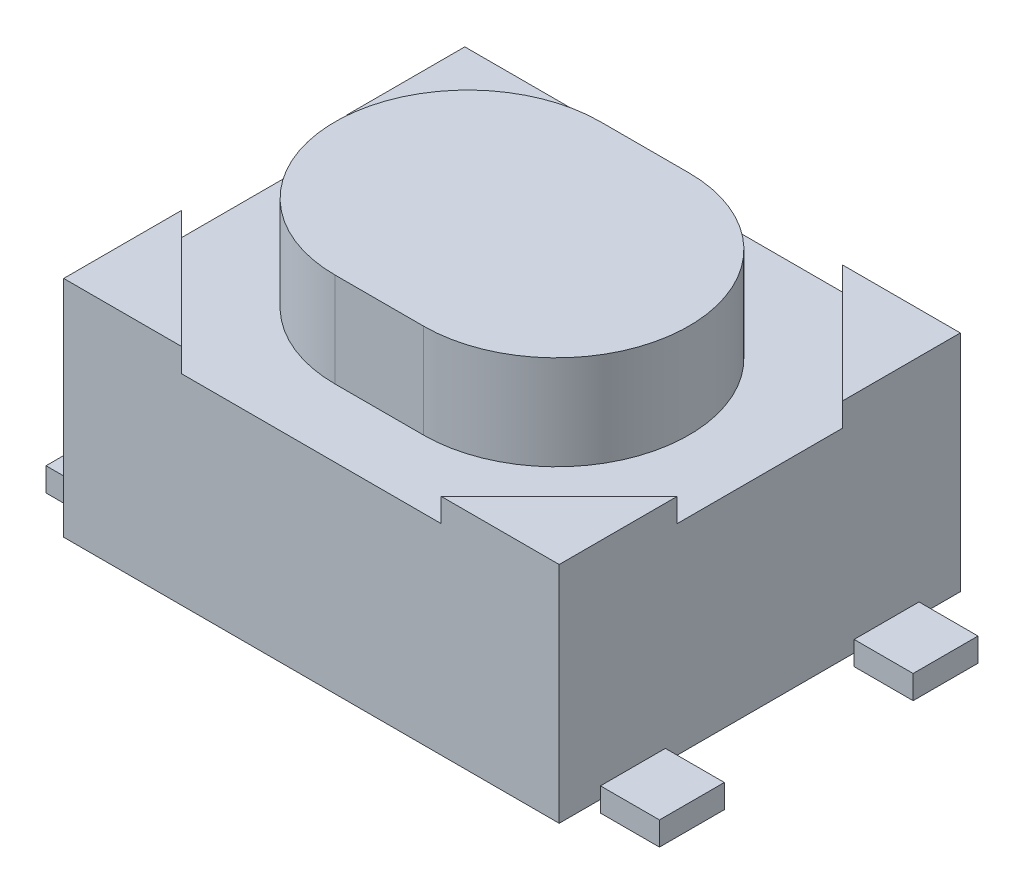
from build123d import *

# Parameters (mm, degrees)
SKETCH1_W           = 4.2
SKETCH1_H           = 3.4
BOSS_EXTRUDE1_DEPTH = 1.7
SKETCH2_W           = 0.5
SKETCH2_H           = 0.55
BOSS_EXTRUDE2_DEPTH = 0.1
BOSS_EXTRUDE3_DEPTH = 0.2
BOSS_EXTRUDE4_DEPTH = 0.8


with BuildPart() as part:
    # Sketch1 → Boss-Extrude1 (new body)
    with BuildSketch(Plane(origin=(0, 0, 0), x_dir=(1, 0, 0), z_dir=(0, 1, 0))):
        Rectangle(SKETCH1_W, SKETCH1_H)
    extrude(amount=BOSS_EXTRUDE1_DEPTH)

    # Sketch2 → Boss-Extrude2 (add, symmetric)
    with BuildSketch(Plane.XZ):
        with Locations((2.35, 1.075)):
            Rectangle(SKETCH2_W, SKETCH2_H)
        with Locations((2.35, -1.075)):
            Rectangle(SKETCH2_W, SKETCH2_H)
        with Locations((-2.35, -1.075)):
            Rectangle(SKETCH2_W, SKETCH2_H)
        with Locations((-2.35, 1.075)):
            Rectangle(SKETCH2_W, SKETCH2_H)
    extrude(amount=BOSS_EXTRUDE2_DEPTH, both=True)

    # Sketch3 → Boss-Extrude3 (add)
    with BuildSketch(Plane(origin=(0, 1.7, 0), x_dir=(1, 0, 0), z_dir=(0, 1, 0))):
        Polygon((-2.1, 1.7), (-1.1, 1.7), (-2.1, 0.7), align=None)
        Polygon((1.1, 1.7), (2.1, 0.7), (2.1, 1.7), align=None)
        Polygon((-2.1, -0.7), (-1.1, -1.7), (-2.1, -1.7), align=None)
        Polygon((1.1, -1.7), (2.1, -0.7), (2.1, -1.7), align=None)
    extrude(amount=BOSS_EXTRUDE3_DEPTH)

    # Sketch4 → Boss-Extrude4 (add)
    with BuildSketch(Plane(origin=(0, 1.7, 0), x_dir=(1, 0, 0), z_dir=(0, 1, 0))):
        with BuildLine():
            Line((0.375, 1.125), (-0.375, 1.125))
            ThreePointArc((-0.375, 1.125), (-0.184760274, 1.10879838), (0, 1.060660172))
            ThreePointArc((0, 1.060660172), (0.184760274, 1.10879838), (0.375, 1.125))
        make_face()
        with BuildLine():
            ThreePointArc((0, -1.060660172), (-0.184760274, -1.10879838), (-0.375, -1.125))
            Line((-0.375, -1.125), (0.375, -1.125))
            ThreePointArc((0.375, -1.125), (0.184760274, -1.10879838), (0, -1.060660172))
        make_face()
        with BuildLine():
            ThreePointArc((0, 1.060660172), (-0.198360449, 0.967927061), (-0.375, 0.838525492))
            Line((-0.375, 0.838525492), (-0.375, -0.838525492))
            ThreePointArc((-0.375, -0.838525492), (-0.198360449, -0.967927061), (0, -1.060660172))
            ThreePointArc((0, -1.060660172), (0.198360449, -0.967927061), (0.375, -0.838525492))
            Line((0.375, -0.838525492), (0.375, 0.838525492))
            ThreePointArc((0.375, 0.838525492), (0.198360449, 0.967927061), (0, 1.060660172))
        make_face()
        with BuildLine():
            ThreePointArc((1.5, 0), (1.170495129, 0.795495129), (0.375, 1.125))
            Line((0.375, 1.125), (0.375, 0.838525492))
            ThreePointArc((0.375, 0.838525492), (0.651979795, 0.459279327), (0.75, 0))
            ThreePointArc((0.75, 0), (0.651979795, -0.459279327), (0.375, -0.838525492))
            Line((0.375, -0.838525492), (0.375, -1.125))
            ThreePointArc((0.375, -1.125), (1.170495129, -0.795495129), (1.5, 0))
        make_face()
        with BuildLine():
            Line((0.375, 0.838525492), (0.375, 1.125))
            ThreePointArc((0.375, 1.125), (0.184760274, 1.10879838), (0, 1.060660172))
            ThreePointArc((0, 1.060660172), (0.198360449, 0.967927061), (0.375, 0.838525492))
        make_face()
        with BuildLine():
            ThreePointArc((0, -1.060660172), (0.184760274, -1.10879838), (0.375, -1.125))
            Line((0.375, -1.125), (0.375, -0.838525492))
            ThreePointArc((0.375, -0.838525492), (0.198360449, -0.967927061), (0, -1.060660172))
        make_face()
        with BuildLine():
            ThreePointArc((0, 1.060660172), (-0.184760274, 1.10879838), (-0.375, 1.125))
            Line((-0.375, 1.125), (-0.375, 0.838525492))
            ThreePointArc((-0.375, 0.838525492), (-0.198360449, 0.967927061), (0, 1.060660172))
        make_face()
        with BuildLine():
            Line((-0.375, 0.838525492), (-0.375, 1.125))
            ThreePointArc((-0.375, 1.125), (-1.5, 0), (-0.375, -1.125))
            Line((-0.375, -1.125), (-0.375, -0.838525492))
            ThreePointArc((-0.375, -0.838525492), (-0.75, 0), (-0.375, 0.838525492))
        make_face()
        with BuildLine():
            Line((-0.375, -0.838525492), (-0.375, -1.125))
            ThreePointArc((-0.375, -1.125), (-0.184760274, -1.10879838), (0, -1.060660172))
            ThreePointArc((0, -1.060660172), (-0.198360449, -0.967927061), (-0.375, -0.838525492))
        make_face()
        with BuildLine():
            ThreePointArc((0.75, 0), (0.651979795, 0.459279327), (0.375, 0.838525492))
            Line((0.375, 0.838525492), (0.375, -0.838525492))
            ThreePointArc((0.375, -0.838525492), (0.651979795, -0.459279327), (0.75, 0))
        make_face()
        with BuildLine():
            Line((-0.375, -0.838525492), (-0.375, 0.838525492))
            ThreePointArc((-0.375, 0.838525492), (-0.75, 0), (-0.375, -0.838525492))
        make_face()
    extrude(amount=BOSS_EXTRUDE4_DEPTH)


solid = part.part
